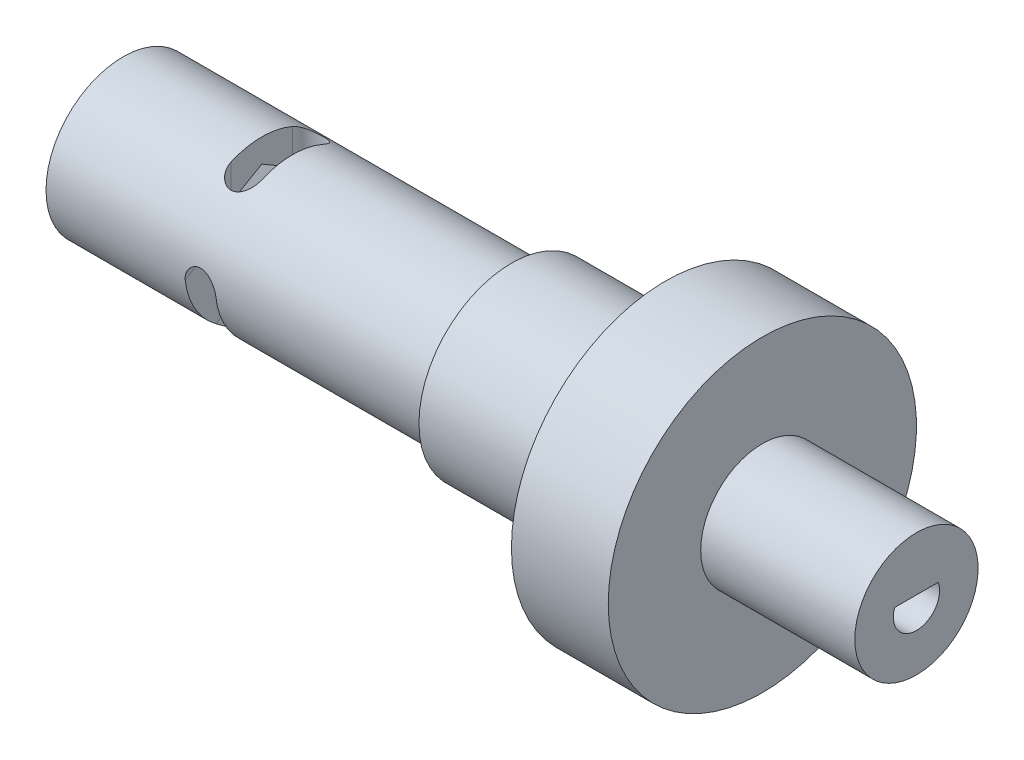
from build123d import *

# Parameters (mm, degrees)
CUT_EXTRUDE1_DEPTH = 10
CUT_EXTRUDE2_DEPTH = 18
CIRPATTERN1_COUNT  = 3
CUT_EXTRUDE3_START = 21.741254
CUT_EXTRUDE3_DEPTH = 4


with BuildPart() as part:
    # Sketch1 → Revolve1 (revolve)
    with BuildSketch(Plane.XY, mode=Mode.PRIVATE) as revolve1_sk:
        Polygon((0, 2.5), (12.6, 2.5), (12.6, 3), (17.6, 3), (17.6, 5), (20.741253759, 5), (20.741253759, 2), (25.741253759, 2), (25.741253759, 0), (0, 0), align=None)
    revolve(revolve1_sk.sketch.rotate(Axis((0, 0, 0), (1, 0, 0)), 90), axis=Axis((0, 0, 0), (1, 0, 0)))

    # Sketch2 → Cut-Extrude1 (cut)
    with BuildSketch(Plane(origin=(0, 0, 0), x_dir=(0, 0, -1), z_dir=(1, 0, 0))):
        Polygon((0, 1.732050808), (-1.5, 0.866025404), (-1.5, -0.866025404), (0, -1.732050808), (1.5, -0.866025404), (1.5, 0.866025404), align=None)
    extrude(amount=CUT_EXTRUDE1_DEPTH, mode=Mode.SUBTRACT)

    # Sketch3 → Cut-Extrude2 (cut)
    with BuildSketch(Plane(origin=(0, 0, 0), x_dir=(1, 0, 0), z_dir=(0, 1, 0))):
        with BuildLine():
            Line((5.5, 1), (5.5, -1))
            ThreePointArc((5.5, -1), (5, -1.5), (4.5, -1))
            Line((4.5, -1), (4.5, 1))
            ThreePointArc((4.5, 1), (5, 1.5), (5.5, 1))
        make_face()
    cut_extrude2 = extrude(amount=CUT_EXTRUDE2_DEPTH, mode=Mode.SUBTRACT)

    # CirPattern1: Cut-Extrude2 ×3 about axis
    cirpattern1_axis = Axis((0, 0, 0), (-1, 0, 0))
    for i in range(1, CIRPATTERN1_COUNT):
        add(cut_extrude2.rotate(cirpattern1_axis, i * 360 / CIRPATTERN1_COUNT), mode=Mode.SUBTRACT)

    # Sketch4 → Cut-Extrude3 (cut)
    with BuildSketch(Plane(origin=(0, 0, 0), x_dir=(0, 0, -1), z_dir=(1, 0, 0)).offset(CUT_EXTRUDE3_START)):
        with BuildLine():
            Line((0.707106781, 0.25), (-0.707106781, 0.25))
            ThreePointArc((-0.707106781, 0.25), (-0.126826484, -0.73919892), (0.75, 0))
            ThreePointArc((0.75, 0), (0.73919892, 0.126826484), (0.707106781, 0.25))
        make_face()
    extrude(amount=CUT_EXTRUDE3_DEPTH, mode=Mode.SUBTRACT)


solid = part.part
